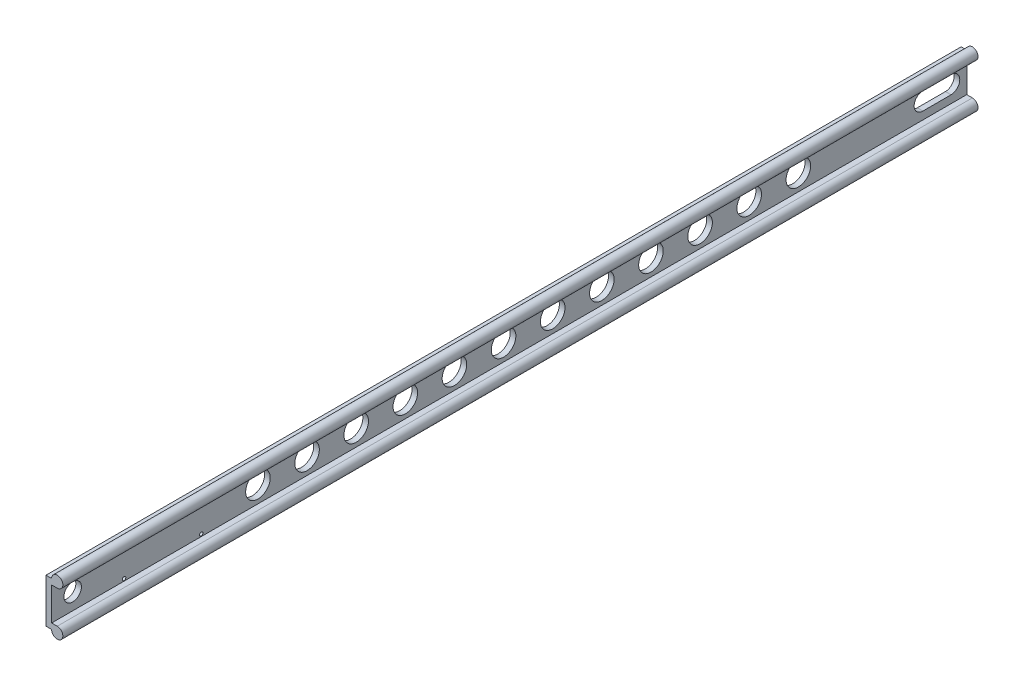
from build123d import *

# Parameters (mm, degrees)
BOSS_EXTRUDE1_DEPTH = 828.04
SKETCH2_R           = 11.1125
CUT_EXTRUDE1_DEPTH  = 25.4
LPATTERN1_COUNT     = 12
LPATTERN1_PITCH     = 44.45
SKETCH3_R           = 7.9375
CUT_EXTRUDE2_DEPTH  = 25.4
SKETCH5_R           = 1.5875
CUT_EXTRUDE3_DEPTH  = 12.7


with BuildPart() as part:
    # Sketch1 → Boss-Extrude1 (new body)
    with BuildSketch(Plane.XY):
        with BuildLine():
            Line((-13.154409933, 15.906683314), (-8.074409933, 15.906683314))
            ThreePointArc((-8.074409933, 15.906683314), (0.597692516, 19.498785762), (-2.994409933, 10.826683314))
            Line((-2.994409933, 10.826683314), (-8.074409933, 10.826683314))
            Line((-8.074409933, 10.826683314), (-8.074409933, -19.018316686))
            Line((-8.074409933, -19.018316686), (-2.994409933, -19.018316686))
            ThreePointArc((-2.994409933, -19.018316686), (0.597692516, -27.690419135), (-8.074409933, -24.098316686))
            Line((-8.074409933, -24.098316686), (-13.154409933, -24.098316686))
            Line((-13.154409933, -24.098316686), (-13.154409933, 15.906683314))
        make_face()
    extrude(amount=BOSS_EXTRUDE1_DEPTH)

    # Sketch2 → Cut-Extrude1 (cut)
    with BuildSketch(Plane.ZY.offset(13.154409933)):
        with Locations(Location((152.4, -4.095816686, 0), (0, 0, 270))):
            Circle(SKETCH2_R)
    cut_extrude1 = extrude(amount=-CUT_EXTRUDE1_DEPTH, mode=Mode.SUBTRACT)

    # LPattern1: Cut-Extrude1 ×12
    with Locations(*[(0, 0, i * LPATTERN1_PITCH) for i in range(1, LPATTERN1_COUNT)]):
        add(cut_extrude1, mode=Mode.SUBTRACT)

    # Sketch3 → Cut-Extrude2 (cut)
    with BuildSketch(Plane.ZY.offset(13.154409933)):
        with Locations(Location((808.99, -4.095816686, 0), (0, 0, 270))):
            Circle(SKETCH3_R)
        with BuildLine():
            Line((14.2875, 3.841683314), (39.6875, 3.841683314))
            ThreePointArc((39.6875, 3.841683314), (47.625, -4.095816686), (39.6875, -12.033316686))
            Line((39.6875, -12.033316686), (14.2875, -12.033316686))
            ThreePointArc((14.2875, -12.033316686), (6.35, -4.095816686), (14.2875, 3.841683314))
        make_face()
    extrude(amount=-CUT_EXTRUDE2_DEPTH, mode=Mode.SUBTRACT)

    # Sketch5 → Cut-Extrude3 (cut)
    with BuildSketch(Plane.ZY.offset(13.154409933)):
        with Locations(Location((692.658, 8.794683314, 0), (0, 0, 270))):
            Circle(SKETCH5_R)
        with Locations(Location((762.508, 8.794683314, 0), (0, 0, 270))):
            Circle(SKETCH5_R)
        with Locations(Location((762.508, -16.986316686, 0), (0, 0, 270))):
            Circle(SKETCH5_R)
        with Locations(Location((692.658, -16.986316686, 0), (0, 0, 270))):
            Circle(SKETCH5_R)
    extrude(amount=-CUT_EXTRUDE3_DEPTH, mode=Mode.SUBTRACT)


solid = part.part
